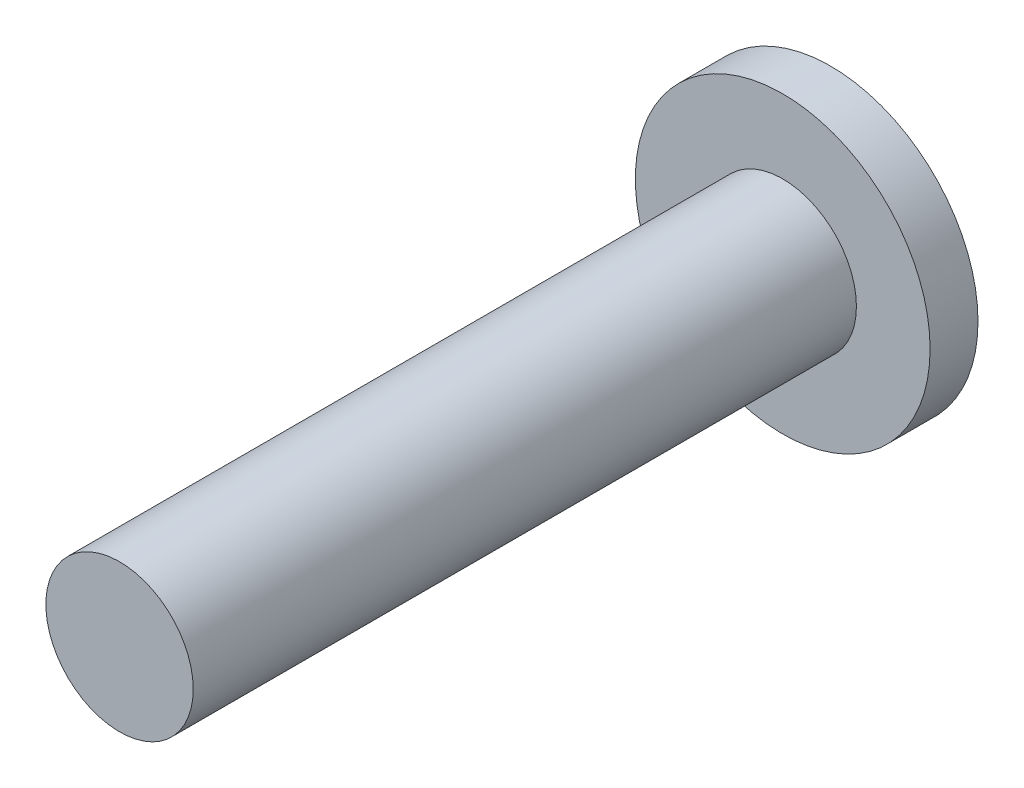
from build123d import *

# Parameters (mm, degrees)
SKETCH_1_R          = 4
EXTRUDE_1_DEPTH     = 1.3
SKETCH_2_R          = 2
EXTRUDE_2_DEPTH     = 18
CUT_EXTRUDE_1_DEPTH = 1


with BuildPart() as part:
    # 草图1 → 凸台-拉伸1 (new body)
    with BuildSketch(Plane.XY):
        Circle(SKETCH_1_R)
    extrude(amount=EXTRUDE_1_DEPTH)

    # 草图2 → 凸台-拉伸2 (add)
    with BuildSketch(Plane.XY.offset(1.3)):
        Circle(SKETCH_2_R)
    extrude(amount=EXTRUDE_2_DEPTH)

    # 草图3 → 切除-拉伸1 (cut)
    with BuildSketch(Plane(origin=(0, 0, 0), x_dir=(-1, 0, 0), z_dir=(0, 0, -1))):
        Polygon((1.443375673, 0), (0.721687836, 1.25), (-0.721687836, 1.25), (-1.443375673, 0), (-0.721687836, -1.25), (0.721687836, -1.25), align=None)
    extrude(amount=-CUT_EXTRUDE_1_DEPTH, mode=Mode.SUBTRACT)


solid = part.part
